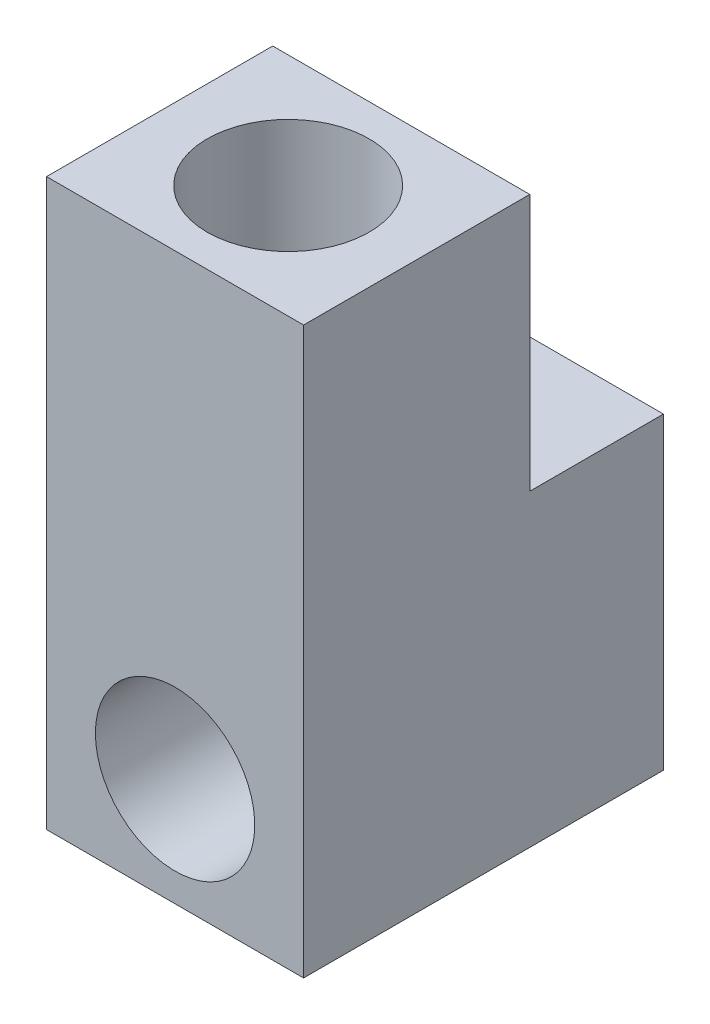
from build123d import *

# Parameters (mm, degrees)
SKETCH_1_W          = 5
SKETCH_1_H          = 7
EXTRUDE_1_DEPTH     = 11
SKETCH_3_R          = 1.575
CUT_EXTRUDE_1_DEPTH = 7
SKETCH_4_R          = 1.55
CUT_EXTRUDE_2_DEPTH = 7
SKETCH_5_W          = 5
SKETCH_5_H          = 2.6
CUT_EXTRUDE_3_DEPTH = 5


with BuildPart() as part:
    # Эскиз1 → Бобышка-Вытянуть1 (new body)
    with BuildSketch(Plane(origin=(0, 0, 0), x_dir=(1, 0, 0), z_dir=(0, 1, 0))):
        Rectangle(SKETCH_1_W, SKETCH_1_H)
    extrude(amount=EXTRUDE_1_DEPTH)

    # Эскиз3 → Вырез-Вытянуть1 (cut)
    with BuildSketch(Plane(origin=(0, 11, 0), x_dir=(1, 0, 0), z_dir=(0, 1, 0))):
        with Locations(Location((0, -1.3, 0), (0, 0, 270))):
            Circle(SKETCH_3_R)
    extrude(amount=-CUT_EXTRUDE_1_DEPTH, mode=Mode.SUBTRACT)

    # Эскиз4 → Вырез-Вытянуть2 (cut)
    with BuildSketch(Plane(origin=(0, 0, -3.5), x_dir=(-1, 0, 0), z_dir=(0, 0, -1))):
        with Locations((0, 2.1)):
            Circle(SKETCH_4_R)
    extrude(amount=-CUT_EXTRUDE_2_DEPTH, mode=Mode.SUBTRACT)

    # Эскиз5 → Вырез-Вытянуть3 (cut)
    with BuildSketch(Plane(origin=(0, 11, 0), x_dir=(1, 0, 0), z_dir=(0, 1, 0))):
        with Locations((0, 2.2)):
            Rectangle(SKETCH_5_W, SKETCH_5_H)
    extrude(amount=-CUT_EXTRUDE_3_DEPTH, mode=Mode.SUBTRACT)


solid = part.part
